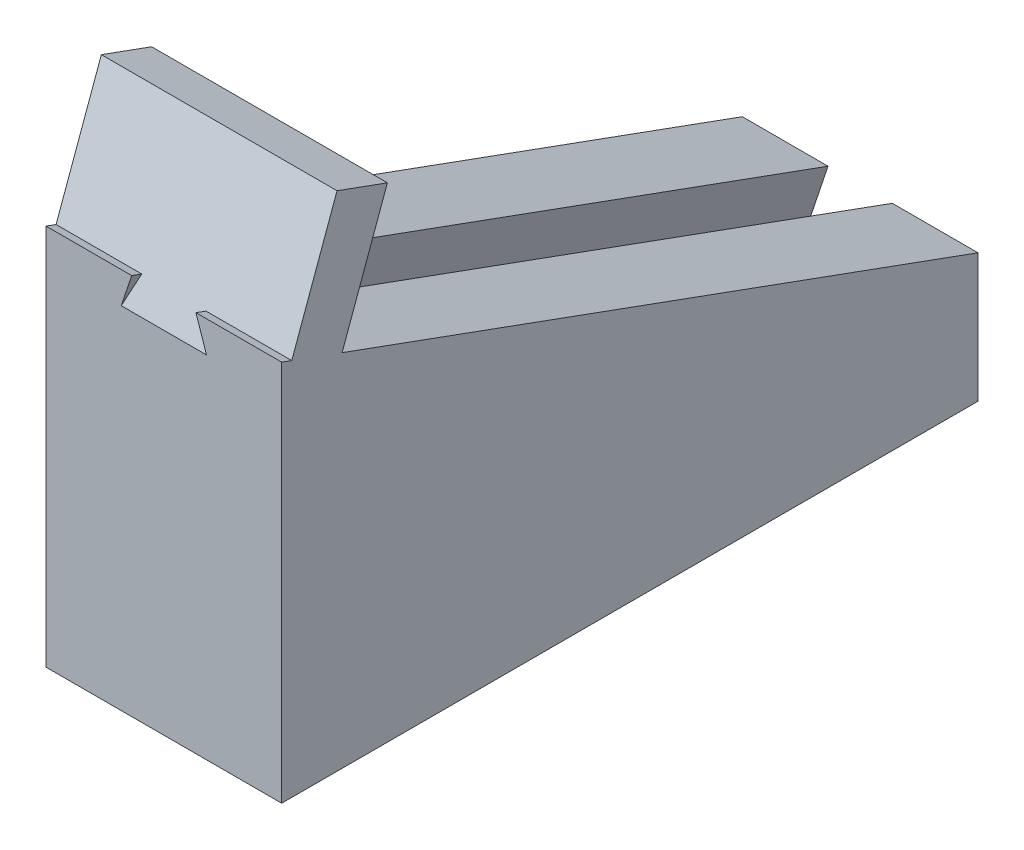
from build123d import *

# Parameters (mm, degrees)
BOSS_EXTRUDE1_DEPTH = 11
BOSS_EXTRUDE2_REACH = 31.074


with BuildPart() as part:
    # Sketch2 → Boss-Extrude1 (new body)
    with BuildSketch(Plane(origin=(0, 0, 0), x_dir=(0, 0, -1), z_dir=(1, 0, 0))):
        Polygon((-7.428495294, -9.782945939), (25.071504706, -9.782945939), (25.071504706, -3.782945939), (-7.428495294, 8.046086675), align=None)
    extrude(amount=-BOSS_EXTRUDE1_DEPTH)

    # Cut-Sweep3: sweep along a path in Sketch5
    with BuildLine(Plane.ZY.offset(11)) as cut_sweep3_path:
        Line((-25.071504706, -6.975479256), (8.757429642, 5.337245904))
    # Sketch3 → Cut-Sweep3 (sweep, cut)
    with BuildSketch(Plane(origin=(0, 0, -25.071504706), x_dir=(-1, 0, 0), z_dir=(0, 0, -1))):
        Polygon((3, -6.782945939), (8, -6.782945939), (7, -3.782945939), (4, -3.782945939), align=None)
    sweep(path=cut_sweep3_path.line, mode=Mode.SUBTRACT)

    # Boss-Extrude2: up to this face of the body (flat: up to its plane)
    boss_extrude2_end = Plane(part.part.faces().sort_by_distance((0, -3.336347692, -6.132602991))[0])
    # Sketch6 → Boss-Extrude2 (add, up to the picked face)
    with BuildSketch(Plane.ZY.offset(11), mode=Mode.PRIVATE) as boss_extrude2_sk1:
        Polygon((5.573598846, 4.37095958), (7.428495294, 5.046086675), (7.428495294, 6.584184475), (4.844649108, 13.683243526), (2.495417556, 12.828193167), align=None)
    boss_extrude2_tool1 = split(extrude(boss_extrude2_sk1.sketch, amount=-BOSS_EXTRUDE2_REACH, mode=Mode.PRIVATE), bisect_by=boss_extrude2_end, keep=Keep.BOTH, mode=Mode.PRIVATE)
    add(boss_extrude2_tool1.solids().sort_by(Axis((-11, 9.08568, 5.168148), (1, 0, 0)))[0])


solid = part.part
